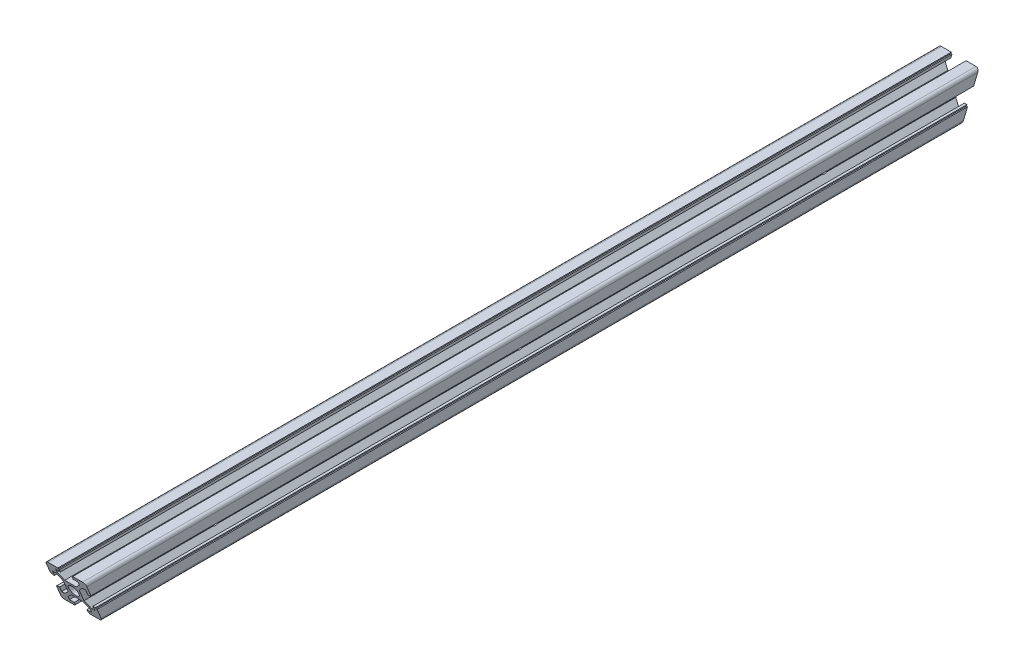
from build123d import *

# Parameters (mm, degrees)
SKETCH_2_R          = 2.55
EXTRUDE_1_DEPTH     = 440
SKETCH_3_R          = 3
CUT_EXTRUDE_1_DEPTH = 441.567815438
CUT_EXTRUDE_2_DEPTH = 20


with BuildPart() as part:
    # 草图2 → 凸台-拉伸1 (new body)
    with BuildSketch(Plane.XY):
        with BuildLine():
            Line((-3.9, 2.839339828), (-6.560660172, 5.5))
            Line((-6.560660172, 5.5), (-8.2, 5.5))
            Line((-8.2, 5.5), (-8.2, 3.1))
            Line((-8.2, 3.1), (-9.45, 3.1))
            Line((-9.45, 3.1), (-9.45, 3.65))
            Line((-9.45, 3.65), (-10, 3.65))
            Line((-10, 3.65), (-10, 8.5))
            ThreePointArc((-10, 8.5), (-9.560660172, 9.560660172), (-8.5, 10))
            Line((-8.5, 10), (-3.65, 10))
            Line((-3.65, 10), (-3.65, 9.45))
            Line((-3.65, 9.45), (-3.1, 9.45))
            Line((-3.1, 9.45), (-3.1, 8.2))
            Line((-3.1, 8.2), (-5.5, 8.2))
            Line((-5.5, 8.2), (-5.5, 6.560660172))
            Line((-5.5, 6.560660172), (-2.839339828, 3.9))
            Line((-2.839339828, 3.9), (2.839339828, 3.9))
            Line((2.839339828, 3.9), (5.5, 6.560660172))
            Line((5.5, 6.560660172), (5.5, 8.2))
            Line((5.5, 8.2), (3.1, 8.2))
            Line((3.1, 8.2), (3.1, 9.45))
            Line((3.1, 9.45), (3.65, 9.45))
            Line((3.65, 9.45), (3.65, 10))
            Line((3.65, 10), (8.5, 10))
            ThreePointArc((8.5, 10), (9.560660172, 9.560660172), (10, 8.5))
            Line((10, 8.5), (10, 3.65))
            Line((10, 3.65), (9.45, 3.65))
            Line((9.45, 3.65), (9.45, 3.1))
            Line((9.45, 3.1), (8.2, 3.1))
            Line((8.2, 3.1), (8.2, 5.5))
            Line((8.2, 5.5), (6.560660172, 5.5))
            Line((6.560660172, 5.5), (3.9, 2.839339828))
            Line((3.9, 2.839339828), (3.9, -2.839339828))
            Line((3.9, -2.839339828), (6.560660172, -5.5))
            Line((6.560660172, -5.5), (8.2, -5.5))
            Line((8.2, -5.5), (8.2, -3.1))
            Line((8.2, -3.1), (9.45, -3.1))
            Line((9.45, -3.1), (9.45, -3.65))
            Line((9.45, -3.65), (10, -3.65))
            Line((10, -3.65), (10, -8.5))
            ThreePointArc((10, -8.5), (9.560660172, -9.560660172), (8.5, -10))
            Line((8.5, -10), (3.65, -10))
            Line((3.65, -10), (3.65, -9.45))
            Line((3.65, -9.45), (3.1, -9.45))
            Line((3.1, -9.45), (3.1, -8.2))
            Line((3.1, -8.2), (5.5, -8.2))
            Line((5.5, -8.2), (5.5, -6.560660172))
            Line((5.5, -6.560660172), (2.839339828, -3.9))
            Line((2.839339828, -3.9), (-2.839339828, -3.9))
            Line((-2.839339828, -3.9), (-5.5, -6.560660172))
            Line((-5.5, -6.560660172), (-5.5, -8.2))
            Line((-5.5, -8.2), (-3.1, -8.2))
            Line((-3.1, -8.2), (-3.1, -9.45))
            Line((-3.1, -9.45), (-3.65, -9.45))
            Line((-3.65, -9.45), (-3.65, -10))
            Line((-3.65, -10), (-8.5, -10))
            ThreePointArc((-8.5, -10), (-9.560660172, -9.560660172), (-10, -8.5))
            Line((-10, -8.5), (-10, -3.65))
            Line((-10, -3.65), (-9.45, -3.65))
            Line((-9.45, -3.65), (-9.45, -3.1))
            Line((-9.45, -3.1), (-8.2, -3.1))
            Line((-8.2, -3.1), (-8.2, -5.5))
            Line((-8.2, -5.5), (-6.560660172, -5.5))
            Line((-6.560660172, -5.5), (-3.9, -2.839339828))
            Line((-3.9, -2.839339828), (-3.9, 2.839339828))
        make_face()
        Circle(SKETCH_2_R, mode=Mode.SUBTRACT)
    extrude(amount=EXTRUDE_1_DEPTH)

    # 草图3 → 切除-拉伸1 (cut, through all)
    with BuildSketch(Plane(origin=(10, 0, 0), x_dir=(0, 0, -1), z_dir=(1, 0, 0))):
        with Locations(Location((-70, 0, 0), (0, 0, 108.835996158))):
            Circle(SKETCH_3_R)
        with Locations(Location((-370, 0, 0), (0, 0, 71.164003842))):
            Circle(SKETCH_3_R)
        with Locations(Location((-220, 0, 0), (0, 0, 71.164003842))):
            Circle(SKETCH_3_R)
    extrude(amount=-CUT_EXTRUDE_1_DEPTH, mode=Mode.SUBTRACT)

    # 草图5 → 切除-拉伸2 (cut)
    with BuildSketch(Plane(origin=(10, 0, 0), x_dir=(0, 0, -1), z_dir=(1, 0, 0))):
        Polygon((-440, 10), (-431.715728753, -10), (-440, -10), align=None)
        Polygon((0, 10), (-8.284271247, -10), (0, -10), align=None)
    extrude(amount=-CUT_EXTRUDE_2_DEPTH, mode=Mode.SUBTRACT)


solid = part.part
